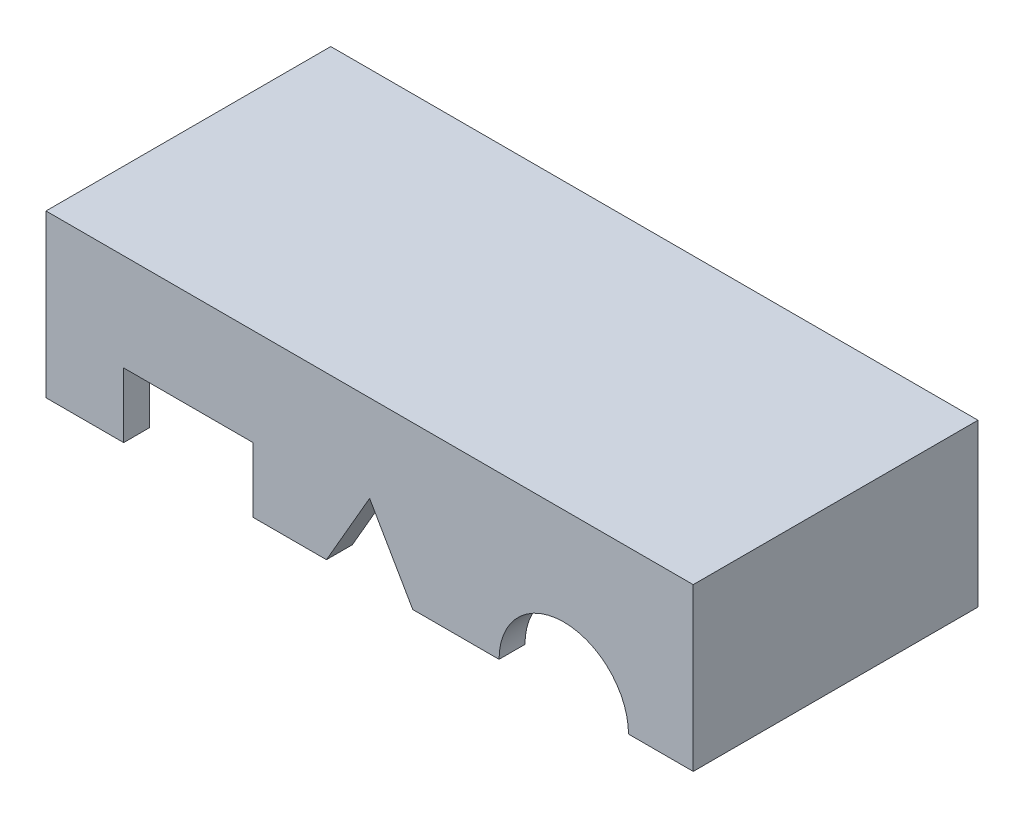
from build123d import *

# Parameters (mm, degrees)
SKETCH1_W               = 250
SKETCH1_H               = 125
SKETCH1_W_2             = 230
SKETCH1_H_2             = 115
BOSS_EXTRUDE1_DEPTH     = 100
SKETCH3_W               = 250
SKETCH3_H               = 125
SKETCH3_W_2             = 230
SKETCH3_H_2             = 115
SKETCH3_R               = 25
SKETCH3_W_3             = 50
SKETCH3_H_3             = 50
BOSS_EXTRUDE4_DEPTH     = 10
CUT_EXTRUDE2_DEPTH      = 178.851764118
CUT_EXTRUDE2_DEPTH_BACK = 178.851764118


with BuildPart() as part:
    # Sketch1 → Boss-Extrude1 (new body)
    with BuildSketch(Plane.XY):
        Rectangle(SKETCH1_W, SKETCH1_H)
        Rectangle(SKETCH1_W_2, SKETCH1_H_2, mode=Mode.SUBTRACT)
    extrude(amount=BOSS_EXTRUDE1_DEPTH)

    # Sketch3 → Boss-Extrude4 (add)
    # profile 1 of 2: a face of its own
    with BuildSketch(Plane.XY.offset(100)):
        Rectangle(SKETCH3_W, SKETCH3_H)
        Rectangle(SKETCH3_W_2, SKETCH3_H_2, mode=Mode.SUBTRACT)
    # profile 2 of 2: a face of its own
    with BuildSketch(Plane.XY.offset(100)):
        Rectangle(SKETCH3_W_2, SKETCH3_H_2)
        with Locations((75, 0)):
            Circle(SKETCH3_R, mode=Mode.SUBTRACT)
        with Locations((-70, 0)):
            Rectangle(SKETCH3_W_3, SKETCH3_H_3, mode=Mode.SUBTRACT)
        Polygon((0, 28.867513459), (25, -14.43375673), (-25, -14.43375673), align=None, mode=Mode.SUBTRACT)
    extrude(amount=BOSS_EXTRUDE4_DEPTH)

    # Sketch4 → Cut-Extrude2 (cut, two sides: drawn at the far end of the back side and taken through both)
    with BuildSketch(Plane.XY.offset(-CUT_EXTRUDE2_DEPTH_BACK)):
        Polygon((-709.844547741, 0), (-138.233831443, 0), (148.761573573, 0), (720.372289871, 0), (720.372289871, -1143.221432596), (-709.844547741, -1143.221432596), align=None)
    extrude(amount=CUT_EXTRUDE2_DEPTH + CUT_EXTRUDE2_DEPTH_BACK, mode=Mode.SUBTRACT)


solid = part.part
